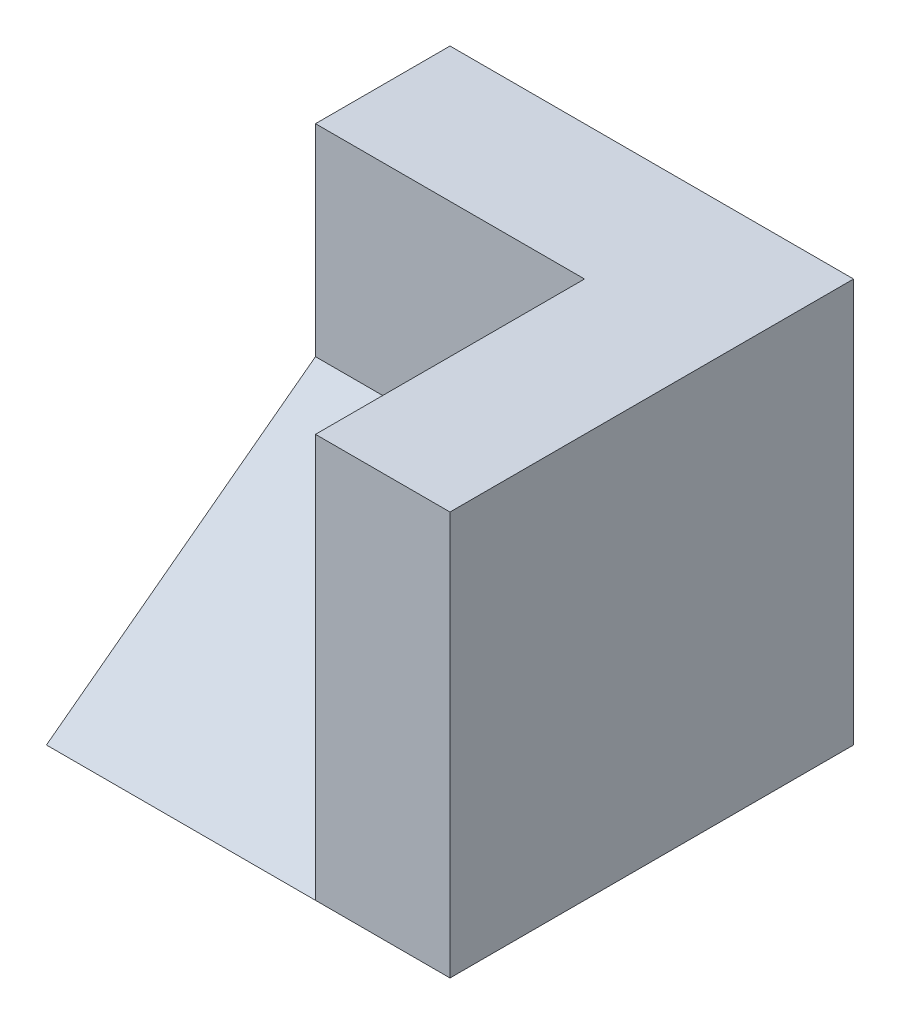
from build123d import *

# Parameters (mm, degrees)
CROQUIS1_W              = 60
CROQUIS1_H              = 60
SALIENTE_EXTRUIR1_DEPTH = 60
CROQUIS2_W              = 40
CROQUIS2_H              = 40
CORTAR_EXTRUIR1_DEPTH   = 60
SALIENTE_EXTRUIR2_DEPTH = 40


with BuildPart() as part:
    # Croquis1 → Saliente-Extruir1 (new body)
    with BuildSketch(Plane.XY):
        with Locations((30, 30)):
            Rectangle(CROQUIS1_W, CROQUIS1_H)
    extrude(amount=-SALIENTE_EXTRUIR1_DEPTH)

    # Croquis2 → Cortar-Extruir1 (cut)
    with BuildSketch(Plane(origin=(0, 60, 0), x_dir=(1, 0, 0), z_dir=(0, 1, 0))):
        with Locations((20, 20)):
            Rectangle(CROQUIS2_W, CROQUIS2_H)
    extrude(amount=-CORTAR_EXTRUIR1_DEPTH, mode=Mode.SUBTRACT)

    # Croquis3 → Saliente-Extruir2 (add)
    with BuildSketch(Plane.ZY.offset(-40)):
        Polygon((-40, 30), (0, 0), (-40, 0), align=None)
    extrude(amount=SALIENTE_EXTRUIR2_DEPTH)


solid = part.part
